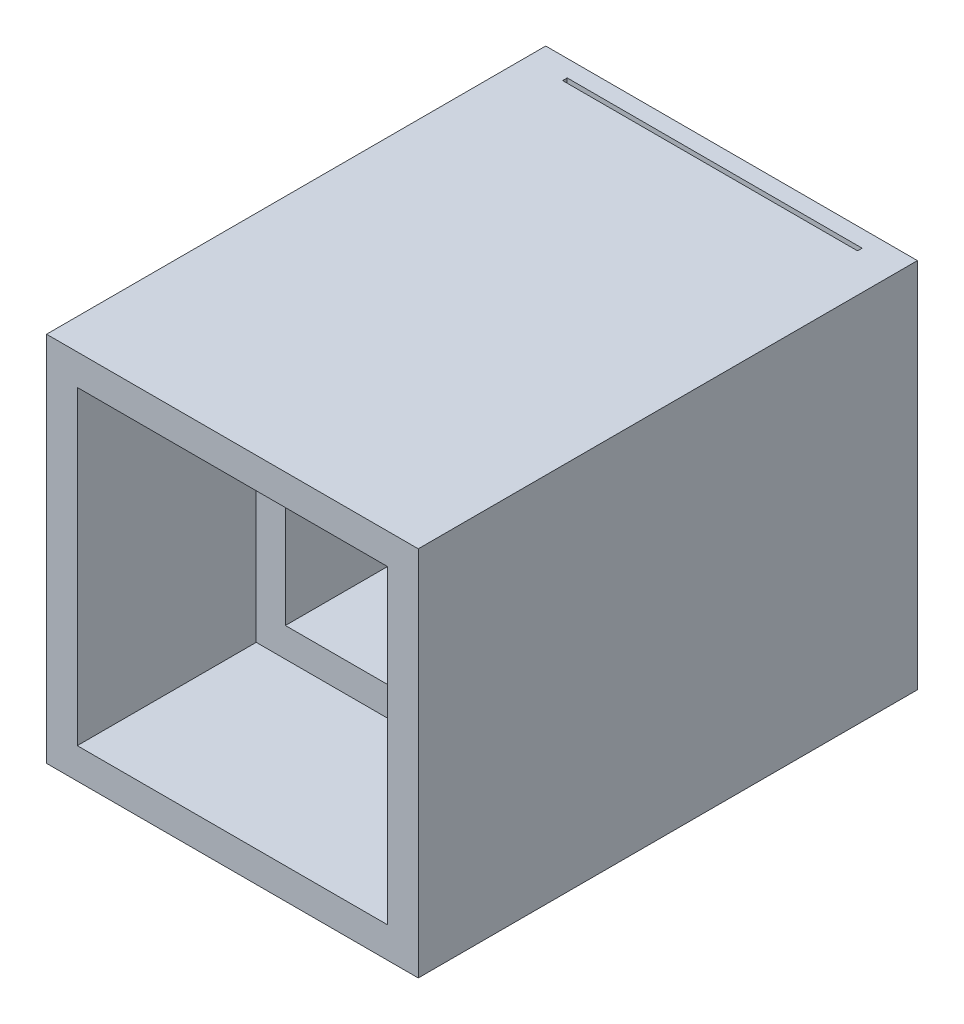
from build123d import *

# Parameters (mm, degrees)
BOSS_EXTRUDE1_DEPTH      = 76.2
BOSS_EXTRUDE1_DEPTH_BACK = 6.35
SKETCH1_W                = 61.468
SKETCH1_H                = 61.468
SKETCH1_3_W              = 41.656
SKETCH1_3_H              = 41.656
CUT_EXTRUDE1_DEPTH       = 88.724554784
SKETCH2_W                = 51.308
SKETCH2_H                = 51.308
CUT_EXTRUDE2_DEPTH       = 69.511409218
SKETCH5_W                = 9.144
SKETCH5_H                = 9.144
CUT_EXTRUDE3_DEPTH       = 94.293408192
SKETCH6_W                = 48.768
SKETCH6_H                = 0.762
CUT_EXTRUDE4_DEPTH       = 55.118


with BuildPart() as part:
    # Sketch1 → Boss-Extrude1 (new, two sides: drawn at the far end of the back side and taken through both)
    with BuildSketch(Plane.XY.offset(-BOSS_EXTRUDE1_DEPTH_BACK)):
        Rectangle(SKETCH1_W, SKETCH1_H)
    extrude(amount=BOSS_EXTRUDE1_DEPTH + BOSS_EXTRUDE1_DEPTH_BACK)

    # Sketch1<3> → Cut-Extrude1 (cut, through all)
    with BuildSketch(Plane.XY):
        Rectangle(SKETCH1_3_W, SKETCH1_3_H)
    extrude(amount=CUT_EXTRUDE1_DEPTH, mode=Mode.SUBTRACT)

    # Sketch2 → Cut-Extrude2 (cut, through all)
    with BuildSketch(Plane.XY.offset(46.609)):
        Rectangle(SKETCH2_W, SKETCH2_H)
    extrude(amount=CUT_EXTRUDE2_DEPTH, mode=Mode.SUBTRACT)

    # Sketch5 → Cut-Extrude3 (cut, through all)
    with BuildSketch(Plane(origin=(0, 0, -6.35), x_dir=(-1, 0, 0), z_dir=(0, 0, -1))):
        Rectangle(SKETCH5_W, SKETCH5_H)
    extrude(amount=-CUT_EXTRUDE3_DEPTH, mode=Mode.SUBTRACT)

    # Sketch6 → Cut-Extrude4 (cut)
    with BuildSketch(Plane(origin=(0, 30.734, 0), x_dir=(1, 0, 0), z_dir=(0, 1, 0))):
        with Locations((0, 3.175)):
            Rectangle(SKETCH6_W, SKETCH6_H)
    extrude(amount=-CUT_EXTRUDE4_DEPTH, mode=Mode.SUBTRACT)


solid = part.part
